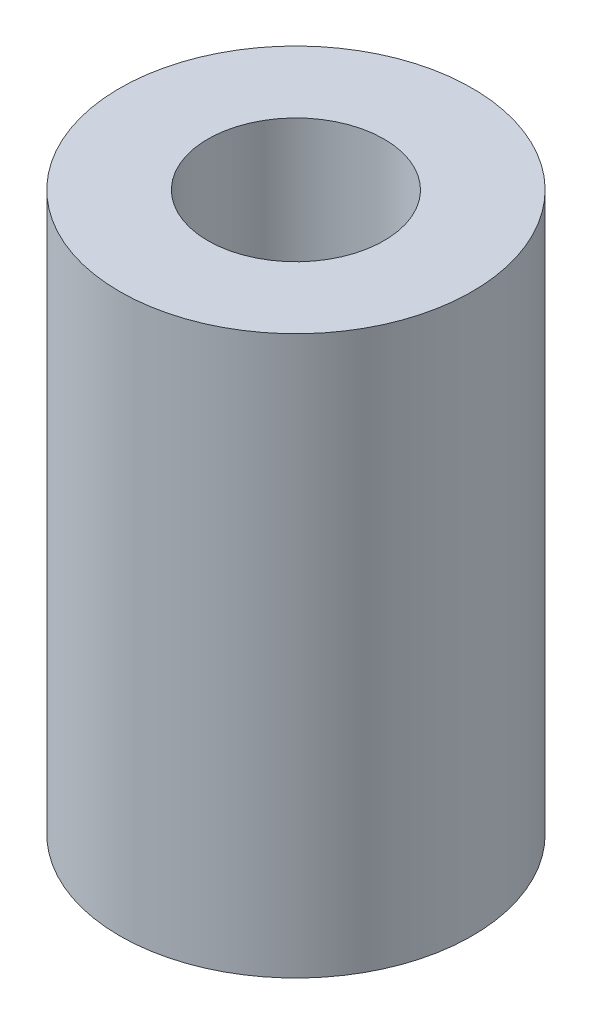
from build123d import *

# Parameters (mm, degrees)
SKETCH1_R           = 6
SKETCH1_R_2         = 3
BOSS_EXTRUDE1_DEPTH = 19


with BuildPart() as part:
    # Sketch1 → Boss-Extrude1 (new body)
    with BuildSketch(Plane(origin=(0, 0, 0), x_dir=(1, 0, 0), z_dir=(0, 1, 0))):
        with Locations(Location((0, 0, 0), (0, 0, 270))):
            Circle(SKETCH1_R)
        with Locations(Location((0, 0, 0), (0, 0, 270))):
            Circle(SKETCH1_R_2, mode=Mode.SUBTRACT)
    extrude(amount=BOSS_EXTRUDE1_DEPTH)


solid = part.part
